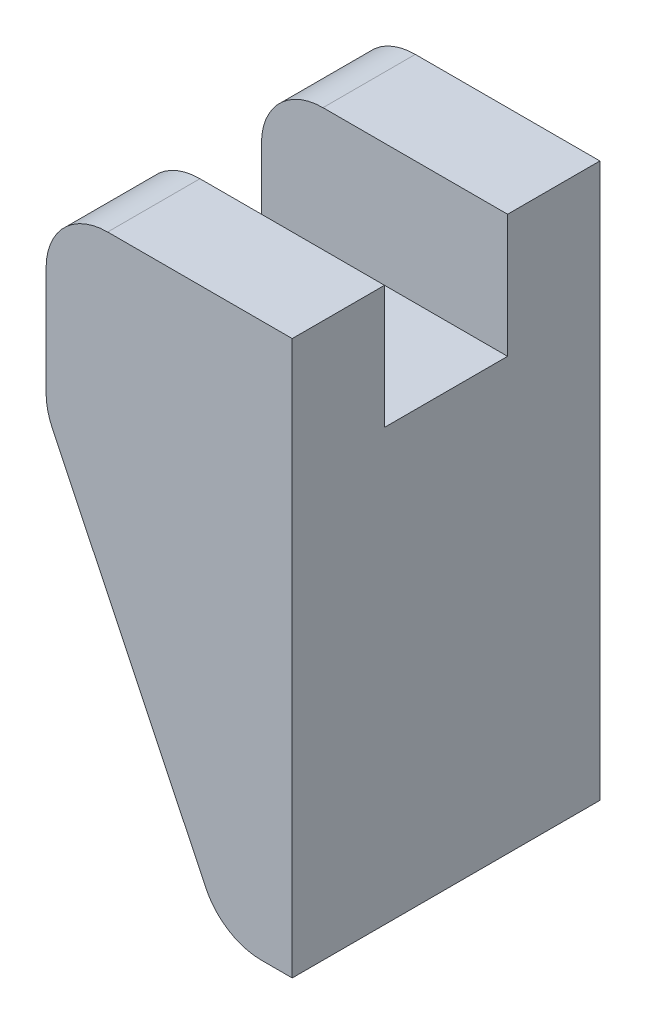
from build123d import *

# Parameters (mm, degrees)
BOSS_EXTRUDE1_DEPTH = 25
SKETCH2_W           = 40
SKETCH2_H           = 20
CUT_EXTRUDE1_DEPTH  = 20
FILLET1_R           = 10
FILLET2_R           = 10


with BuildPart() as part:
    # Sketch1 → Boss-Extrude1 (new, symmetric)
    with BuildSketch(Plane.XY):
        Polygon((0, 45), (-40, 45), (-40, 15), (-11.336760925, -45), (0, -45), align=None)
    extrude(amount=BOSS_EXTRUDE1_DEPTH, both=True)

    # Sketch2 → Cut-Extrude1 (cut)
    with BuildSketch(Plane(origin=(0, 45, 0), x_dir=(1, 0, 0), z_dir=(0, 1, 0))):
        with Locations((-20, 0)):
            Rectangle(SKETCH2_W, SKETCH2_H)
    extrude(amount=-CUT_EXTRUDE1_DEPTH, mode=Mode.SUBTRACT)

    # Fillet1
    fillet1_edges = [part.edges().sort_by_distance(p)[0] for p in [
        (-40, 45, -17.5),
        (-40, 45, 17.5),
    ]]
    fillet(fillet1_edges, radius=FILLET1_R)

    # Fillet2
    fillet2_edges = [part.edges().sort_by_distance(p)[0] for p in [
        (-11.336760925, -45, 0),
        (-40, 15, 0),
    ]]
    fillet(fillet2_edges, radius=FILLET2_R)


solid = part.part
